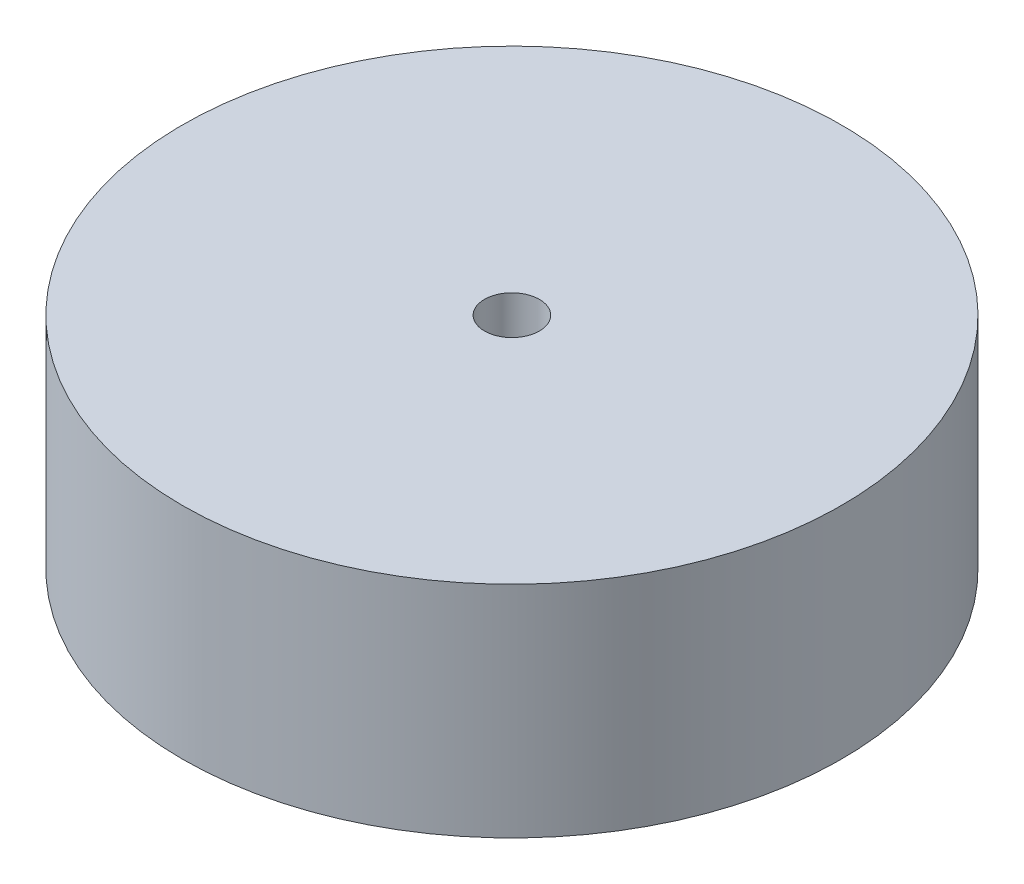
from build123d import *

# Parameters (mm, degrees)
SKETCH1_R           = 38.1
SKETCH1_R_2         = 3.175
BOSS_EXTRUDE1_DEPTH = 25.4


with BuildPart() as part:
    # Sketch1 → Boss-Extrude1 (new body)
    with BuildSketch(Plane(origin=(0, 0, 0), x_dir=(1, 0, 0), z_dir=(0, 1, 0))):
        with Locations(Location((0, 0, 0), (0, 0, 270))):
            Circle(SKETCH1_R)
        with Locations(Location((0, 0, 0), (0, 0, 270))):
            Circle(SKETCH1_R_2, mode=Mode.SUBTRACT)
    extrude(amount=BOSS_EXTRUDE1_DEPTH)


solid = part.part
